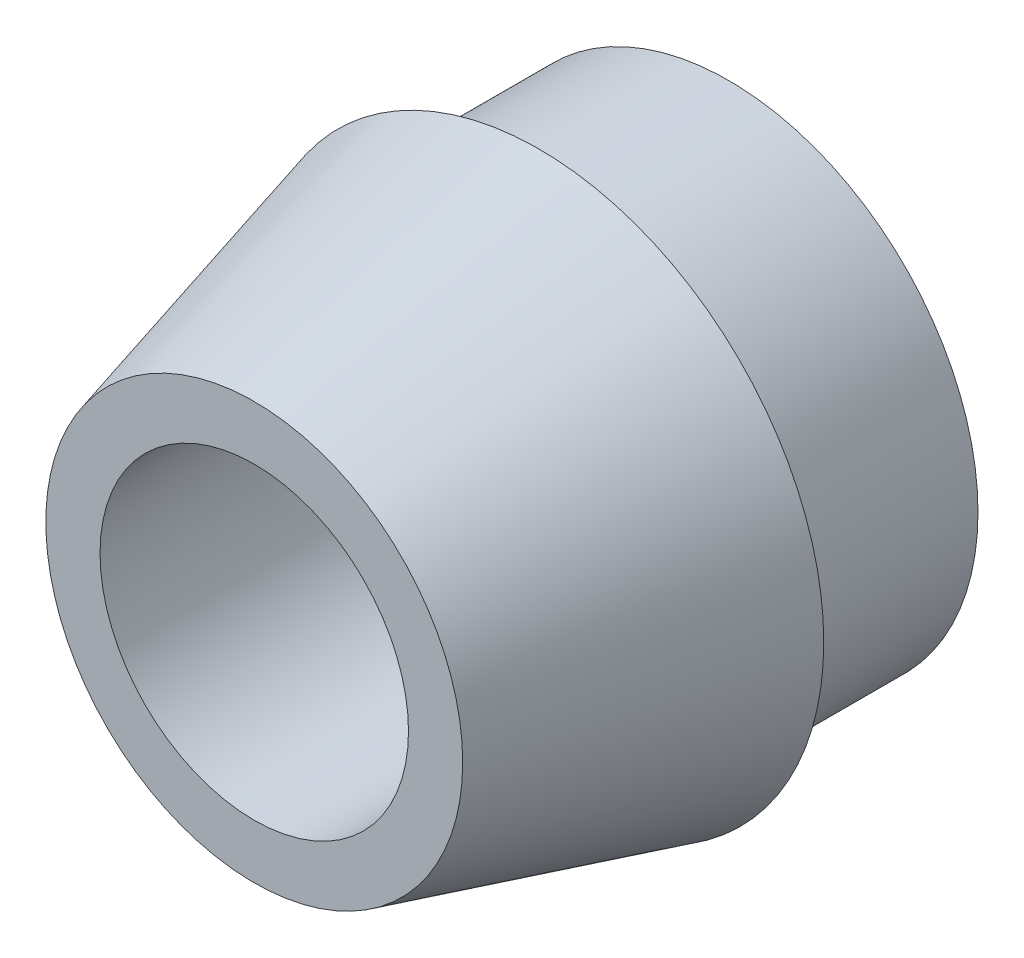
from build123d import *

# Parameters (mm, degrees)
SKETCH3_R           = 52.5
SKETCH3_R_2         = 41.35
BOSS_EXTRUDE3_DEPTH = 40
SKETCH6_R           = 60
BOSS_EXTRUDE5_DEPTH = 60
BOSS_EXTRUDE5_TAPER = 15
SKETCH7_R           = 32.5
CUT_EXTRUDE1_DEPTH  = 132.148770486


with BuildPart() as part:
    # Sketch3 → Boss-Extrude3 (new body)
    with BuildSketch(Plane.XY):
        Circle(SKETCH3_R)
        Circle(SKETCH3_R_2, mode=Mode.SUBTRACT)
    extrude(amount=BOSS_EXTRUDE3_DEPTH)

    # Sketch6 → Boss-Extrude5 (add)
    with BuildSketch(Plane.XY.offset(40)):
        Circle(SKETCH6_R)
    extrude(amount=BOSS_EXTRUDE5_DEPTH, taper=BOSS_EXTRUDE5_TAPER)

    # Sketch7 → Cut-Extrude1 (cut, through all)
    with BuildSketch(Plane.XY.offset(100)):
        Circle(SKETCH7_R)
    extrude(amount=-CUT_EXTRUDE1_DEPTH, mode=Mode.SUBTRACT)


solid = part.part
